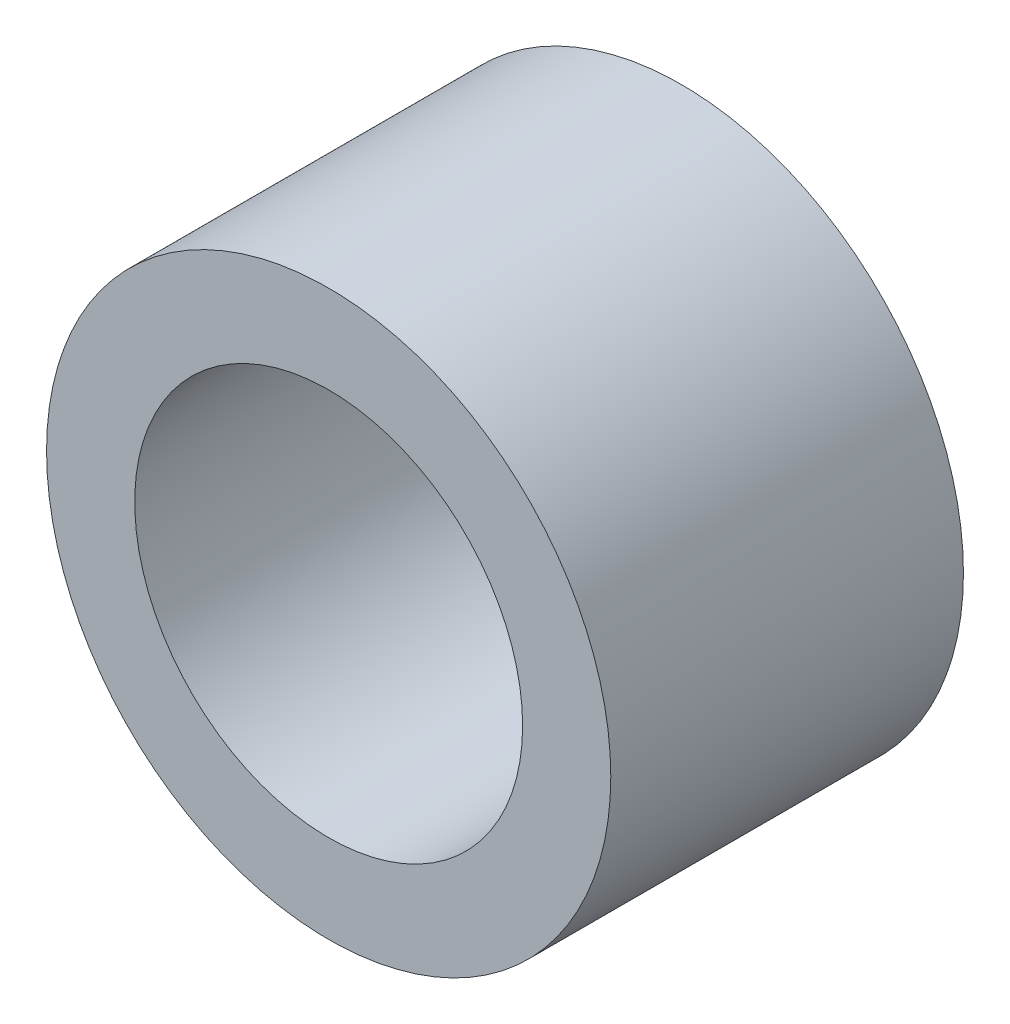
from build123d import *

# Parameters (mm, degrees)
SKETCH1_R                = 4
BOSS_EXTRUDE1_DEPTH      = 5
M5_CLEARANCE_HOLE1_D     = 5.5
M5_CLEARANCE_HOLE1_DEPTH = 10
M5_CLEARANCE_HOLE1_TIP   = 1.652366702


with BuildPart() as part:
    # Sketch1 → Boss-Extrude1 (new body)
    with BuildSketch(Plane.XY):
        Circle(SKETCH1_R)
    extrude(amount=BOSS_EXTRUDE1_DEPTH)

    # M5 Clearance Hole1
    with Locations(Plane.XY.offset(5)):
        with Locations((0, 0)):
            Hole(M5_CLEARANCE_HOLE1_D / 2, depth=M5_CLEARANCE_HOLE1_DEPTH)
            with Locations((0, 0, -(M5_CLEARANCE_HOLE1_DEPTH + M5_CLEARANCE_HOLE1_TIP / 2))):  # 118° drill point
                Cone(0, M5_CLEARANCE_HOLE1_D / 2, M5_CLEARANCE_HOLE1_TIP, mode=Mode.SUBTRACT)


solid = part.part
